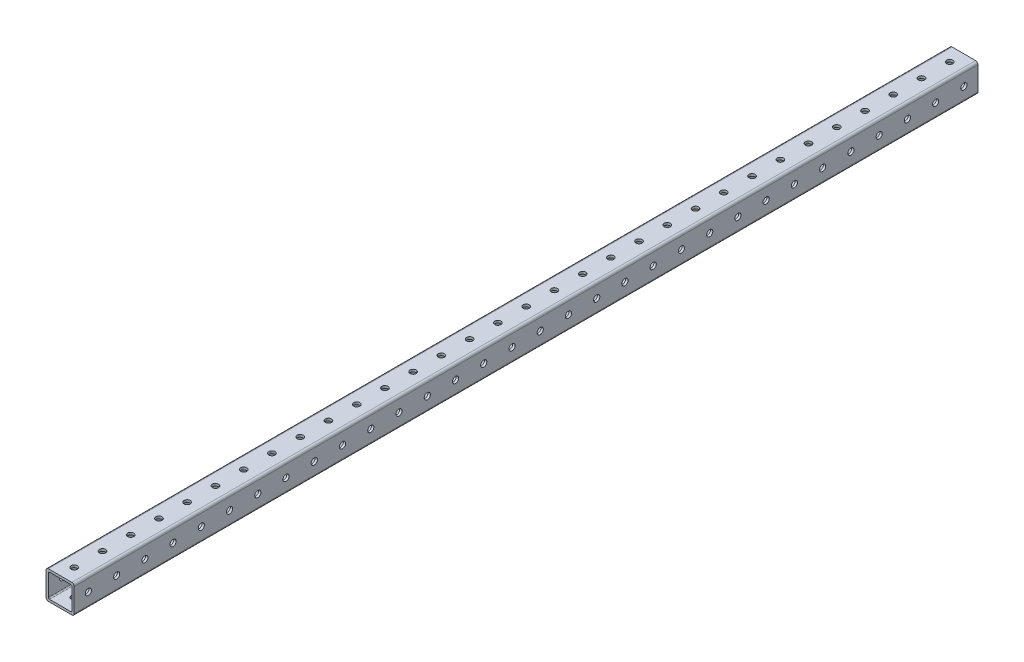
from build123d import *

# Parameters (mm, degrees)
SKETCH1_W                    = 31.75
SKETCH1_H                    = 31.75
EXTRUDE_THIN1_DEPTH          = 609.6
FILLET1_R                    = 1.6002
SKETCH2_R                    = 4.1656
CUT_EXTRUDE1_DEPTH           = 611.195022104
LPATTERN1_COUNT              = 32
LPATTERN1_PITCH              = 38.1
CIRPATTERN1_COUNT            = 2
CIRPATTERN1_ANGLE            = 90
CIRPATTERN1_COPY_1_SKETCH_R  = 4.1656
CIRPATTERN1_COPY_1_DEPTH     = 611.195022104
CIRPATTERN1_COPY_2_SKETCH_R  = 4.1656
CIRPATTERN1_COPY_2_DEPTH     = 611.195022104
CIRPATTERN1_COPY_3_SKETCH_R  = 4.1656
CIRPATTERN1_COPY_3_DEPTH     = 611.195022104
CIRPATTERN1_COPY_4_SKETCH_R  = 4.1656
CIRPATTERN1_COPY_4_DEPTH     = 611.195022104
CIRPATTERN1_COPY_5_SKETCH_R  = 4.1656
CIRPATTERN1_COPY_5_DEPTH     = 611.195022104
CIRPATTERN1_COPY_6_SKETCH_R  = 4.1656
CIRPATTERN1_COPY_6_DEPTH     = 611.195022104
CIRPATTERN1_COPY_7_SKETCH_R  = 4.1656
CIRPATTERN1_COPY_7_DEPTH     = 611.195022104
CIRPATTERN1_COPY_8_SKETCH_R  = 4.1656
CIRPATTERN1_COPY_8_DEPTH     = 611.195022104
CIRPATTERN1_COPY_9_SKETCH_R  = 4.1656
CIRPATTERN1_COPY_9_DEPTH     = 611.195022104
CIRPATTERN1_COPY_10_SKETCH_R = 4.1656
CIRPATTERN1_COPY_10_DEPTH    = 611.195022104
CIRPATTERN1_COPY_11_SKETCH_R = 4.1656
CIRPATTERN1_COPY_11_DEPTH    = 611.195022104
CIRPATTERN1_COPY_12_SKETCH_R = 4.1656
CIRPATTERN1_COPY_12_DEPTH    = 611.195022104
CIRPATTERN1_COPY_13_SKETCH_R = 4.1656
CIRPATTERN1_COPY_13_DEPTH    = 611.195022104
CIRPATTERN1_COPY_14_SKETCH_R = 4.1656
CIRPATTERN1_COPY_14_DEPTH    = 611.195022104
CIRPATTERN1_COPY_15_SKETCH_R = 4.1656
CIRPATTERN1_COPY_15_DEPTH    = 611.195022104
CIRPATTERN1_COPY_16_SKETCH_R = 4.1656
CIRPATTERN1_COPY_16_DEPTH    = 611.195022104
CIRPATTERN1_COPY_17_SKETCH_R = 4.1656
CIRPATTERN1_COPY_17_DEPTH    = 611.195022104
CIRPATTERN1_COPY_18_SKETCH_R = 4.1656
CIRPATTERN1_COPY_18_DEPTH    = 611.195022104
CIRPATTERN1_COPY_19_SKETCH_R = 4.1656
CIRPATTERN1_COPY_19_DEPTH    = 611.195022104
CIRPATTERN1_COPY_20_SKETCH_R = 4.1656
CIRPATTERN1_COPY_20_DEPTH    = 611.195022104
CIRPATTERN1_COPY_21_SKETCH_R = 4.1656
CIRPATTERN1_COPY_21_DEPTH    = 611.195022104
CIRPATTERN1_COPY_22_SKETCH_R = 4.1656
CIRPATTERN1_COPY_22_DEPTH    = 611.195022104
CIRPATTERN1_COPY_23_SKETCH_R = 4.1656
CIRPATTERN1_COPY_23_DEPTH    = 611.195022104
CIRPATTERN1_COPY_24_SKETCH_R = 4.1656
CIRPATTERN1_COPY_24_DEPTH    = 611.195022104
CIRPATTERN1_COPY_25_SKETCH_R = 4.1656
CIRPATTERN1_COPY_25_DEPTH    = 611.195022104
CIRPATTERN1_COPY_26_SKETCH_R = 4.1656
CIRPATTERN1_COPY_26_DEPTH    = 611.195022104
CIRPATTERN1_COPY_27_SKETCH_R = 4.1656
CIRPATTERN1_COPY_27_DEPTH    = 611.195022104
CIRPATTERN1_COPY_28_SKETCH_R = 4.1656
CIRPATTERN1_COPY_28_DEPTH    = 611.195022104
CIRPATTERN1_COPY_29_SKETCH_R = 4.1656
CIRPATTERN1_COPY_29_DEPTH    = 611.195022104
CIRPATTERN1_COPY_30_SKETCH_R = 4.1656
CIRPATTERN1_COPY_30_DEPTH    = 611.195022104
CIRPATTERN1_COPY_31_SKETCH_R = 4.1656
CIRPATTERN1_COPY_31_DEPTH    = 611.195022104


with BuildPart() as part:
    # Sketch1 → Extrude-Thin1 (new, symmetric)
    with BuildSketch(Plane.XY):
        with BuildLine():
            Line((-15.875, 19.05), (15.875, 19.05))
            ThreePointArc((15.875, 19.05), (18.12006403, 18.12006403), (19.05, 15.875))
            Line((19.05, 15.875), (19.05, -15.875))
            ThreePointArc((19.05, -15.875), (18.12006403, -18.12006403), (15.875, -19.05))
            Line((15.875, -19.05), (-15.875, -19.05))
            ThreePointArc((-15.875, -19.05), (-18.12006403, -18.12006403), (-19.05, -15.875))
            Line((-19.05, -15.875), (-19.05, 15.875))
            ThreePointArc((-19.05, 15.875), (-18.12006403, 18.12006403), (-15.875, 19.05))
        make_face()
        Rectangle(SKETCH1_W, SKETCH1_H, mode=Mode.SUBTRACT)
    extrude(amount=EXTRUDE_THIN1_DEPTH, both=True)

    # Fillet1
    fillet1_edges = [part.edges().sort_by_distance(p)[0] for p in [
        (15.875, -15.875, 0),
        (15.875, 15.875, 0),
        (-15.875, 15.875, 0),
        (-15.875, -15.875, 0),
    ]]
    fillet(fillet1_edges, radius=FILLET1_R)

    # Sketch2 → Cut-Extrude1 (cut, symmetric)
    with BuildSketch(Plane(origin=(0, 0, 0), x_dir=(1, 0, 0), z_dir=(0, 1, 0))):
        with Locations(Location((0, -590.55, 0), (0, 0, 270))):
            Circle(SKETCH2_R)
    cut_extrude1 = extrude(amount=CUT_EXTRUDE1_DEPTH, both=True, mode=Mode.SUBTRACT)

    # LPattern1: Cut-Extrude1 ×32
    with Locations(*[(0, 0, -i * LPATTERN1_PITCH) for i in range(1, LPATTERN1_COUNT)]):
        add(cut_extrude1, mode=Mode.SUBTRACT)

    # CirPattern1: Cut-Extrude1 ×2 about axis
    cirpattern1_axis = Axis((0, 0, 590.55), (0, 0, -1))
    for i in range(1, CIRPATTERN1_COUNT):
        add(cut_extrude1.rotate(cirpattern1_axis, i * CIRPATTERN1_ANGLE / (CIRPATTERN1_COUNT - 1)), mode=Mode.SUBTRACT)

    # CirPattern1 copy 1 sketch → CirPattern1 copy 1 (cut, symmetric)
    with BuildSketch(Plane(origin=(0, 0, -38.1), x_dir=(0, -1, 0), z_dir=(1, 0, 0))):
        with Locations(Location((0, -590.55, 0), (0, 0, 270))):
            Circle(CIRPATTERN1_COPY_1_SKETCH_R)
    extrude(amount=CIRPATTERN1_COPY_1_DEPTH, both=True, mode=Mode.SUBTRACT)

    # CirPattern1 copy 2 sketch → CirPattern1 copy 2 (cut, symmetric)
    with BuildSketch(Plane(origin=(0, 0, -76.2), x_dir=(0, -1, 0), z_dir=(1, 0, 0))):
        with Locations(Location((0, -590.55, 0), (0, 0, 270))):
            Circle(CIRPATTERN1_COPY_2_SKETCH_R)
    extrude(amount=CIRPATTERN1_COPY_2_DEPTH, both=True, mode=Mode.SUBTRACT)

    # CirPattern1 copy 3 sketch → CirPattern1 copy 3 (cut, symmetric)
    with BuildSketch(Plane(origin=(0, 0, -114.3), x_dir=(0, -1, 0), z_dir=(1, 0, 0))):
        with Locations(Location((0, -590.55, 0), (0, 0, 270))):
            Circle(CIRPATTERN1_COPY_3_SKETCH_R)
    extrude(amount=CIRPATTERN1_COPY_3_DEPTH, both=True, mode=Mode.SUBTRACT)

    # CirPattern1 copy 4 sketch → CirPattern1 copy 4 (cut, symmetric)
    with BuildSketch(Plane(origin=(0, 0, -152.4), x_dir=(0, -1, 0), z_dir=(1, 0, 0))):
        with Locations(Location((0, -590.55, 0), (0, 0, 270))):
            Circle(CIRPATTERN1_COPY_4_SKETCH_R)
    extrude(amount=CIRPATTERN1_COPY_4_DEPTH, both=True, mode=Mode.SUBTRACT)

    # CirPattern1 copy 5 sketch → CirPattern1 copy 5 (cut, symmetric)
    with BuildSketch(Plane(origin=(0, 0, -190.5), x_dir=(0, -1, 0), z_dir=(1, 0, 0))):
        with Locations(Location((0, -590.55, 0), (0, 0, 270))):
            Circle(CIRPATTERN1_COPY_5_SKETCH_R)
    extrude(amount=CIRPATTERN1_COPY_5_DEPTH, both=True, mode=Mode.SUBTRACT)

    # CirPattern1 copy 6 sketch → CirPattern1 copy 6 (cut, symmetric)
    with BuildSketch(Plane(origin=(0, 0, -228.6), x_dir=(0, -1, 0), z_dir=(1, 0, 0))):
        with Locations(Location((0, -590.55, 0), (0, 0, 270))):
            Circle(CIRPATTERN1_COPY_6_SKETCH_R)
    extrude(amount=CIRPATTERN1_COPY_6_DEPTH, both=True, mode=Mode.SUBTRACT)

    # CirPattern1 copy 7 sketch → CirPattern1 copy 7 (cut, symmetric)
    with BuildSketch(Plane(origin=(0, 0, -266.7), x_dir=(0, -1, 0), z_dir=(1, 0, 0))):
        with Locations(Location((0, -590.55, 0), (0, 0, 270))):
            Circle(CIRPATTERN1_COPY_7_SKETCH_R)
    extrude(amount=CIRPATTERN1_COPY_7_DEPTH, both=True, mode=Mode.SUBTRACT)

    # CirPattern1 copy 8 sketch → CirPattern1 copy 8 (cut, symmetric)
    with BuildSketch(Plane(origin=(0, 0, -304.8), x_dir=(0, -1, 0), z_dir=(1, 0, 0))):
        with Locations(Location((0, -590.55, 0), (0, 0, 270))):
            Circle(CIRPATTERN1_COPY_8_SKETCH_R)
    extrude(amount=CIRPATTERN1_COPY_8_DEPTH, both=True, mode=Mode.SUBTRACT)

    # CirPattern1 copy 9 sketch → CirPattern1 copy 9 (cut, symmetric)
    with BuildSketch(Plane(origin=(0, 0, -342.9), x_dir=(0, -1, 0), z_dir=(1, 0, 0))):
        with Locations(Location((0, -590.55, 0), (0, 0, 270))):
            Circle(CIRPATTERN1_COPY_9_SKETCH_R)
    extrude(amount=CIRPATTERN1_COPY_9_DEPTH, both=True, mode=Mode.SUBTRACT)

    # CirPattern1 copy 10 sketch → CirPattern1 copy 10 (cut, symmetric)
    with BuildSketch(Plane(origin=(0, 0, -381), x_dir=(0, -1, 0), z_dir=(1, 0, 0))):
        with Locations(Location((0, -590.55, 0), (0, 0, 270))):
            Circle(CIRPATTERN1_COPY_10_SKETCH_R)
    extrude(amount=CIRPATTERN1_COPY_10_DEPTH, both=True, mode=Mode.SUBTRACT)

    # CirPattern1 copy 11 sketch → CirPattern1 copy 11 (cut, symmetric)
    with BuildSketch(Plane(origin=(0, 0, -419.1), x_dir=(0, -1, 0), z_dir=(1, 0, 0))):
        with Locations(Location((0, -590.55, 0), (0, 0, 270))):
            Circle(CIRPATTERN1_COPY_11_SKETCH_R)
    extrude(amount=CIRPATTERN1_COPY_11_DEPTH, both=True, mode=Mode.SUBTRACT)

    # CirPattern1 copy 12 sketch → CirPattern1 copy 12 (cut, symmetric)
    with BuildSketch(Plane(origin=(0, 0, -457.2), x_dir=(0, -1, 0), z_dir=(1, 0, 0))):
        with Locations(Location((0, -590.55, 0), (0, 0, 270))):
            Circle(CIRPATTERN1_COPY_12_SKETCH_R)
    extrude(amount=CIRPATTERN1_COPY_12_DEPTH, both=True, mode=Mode.SUBTRACT)

    # CirPattern1 copy 13 sketch → CirPattern1 copy 13 (cut, symmetric)
    with BuildSketch(Plane(origin=(0, 0, -495.3), x_dir=(0, -1, 0), z_dir=(1, 0, 0))):
        with Locations(Location((0, -590.55, 0), (0, 0, 270))):
            Circle(CIRPATTERN1_COPY_13_SKETCH_R)
    extrude(amount=CIRPATTERN1_COPY_13_DEPTH, both=True, mode=Mode.SUBTRACT)

    # CirPattern1 copy 14 sketch → CirPattern1 copy 14 (cut, symmetric)
    with BuildSketch(Plane(origin=(0, 0, -533.4), x_dir=(0, -1, 0), z_dir=(1, 0, 0))):
        with Locations(Location((0, -590.55, 0), (0, 0, 270))):
            Circle(CIRPATTERN1_COPY_14_SKETCH_R)
    extrude(amount=CIRPATTERN1_COPY_14_DEPTH, both=True, mode=Mode.SUBTRACT)

    # CirPattern1 copy 15 sketch → CirPattern1 copy 15 (cut, symmetric)
    with BuildSketch(Plane(origin=(0, 0, -571.5), x_dir=(0, -1, 0), z_dir=(1, 0, 0))):
        with Locations(Location((0, -590.55, 0), (0, 0, 270))):
            Circle(CIRPATTERN1_COPY_15_SKETCH_R)
    extrude(amount=CIRPATTERN1_COPY_15_DEPTH, both=True, mode=Mode.SUBTRACT)

    # CirPattern1 copy 16 sketch → CirPattern1 copy 16 (cut, symmetric)
    with BuildSketch(Plane(origin=(0, 0, -609.6), x_dir=(0, -1, 0), z_dir=(1, 0, 0))):
        with Locations(Location((0, -590.55, 0), (0, 0, 270))):
            Circle(CIRPATTERN1_COPY_16_SKETCH_R)
    extrude(amount=CIRPATTERN1_COPY_16_DEPTH, both=True, mode=Mode.SUBTRACT)

    # CirPattern1 copy 17 sketch → CirPattern1 copy 17 (cut, symmetric)
    with BuildSketch(Plane(origin=(0, 0, -647.7), x_dir=(0, -1, 0), z_dir=(1, 0, 0))):
        with Locations(Location((0, -590.55, 0), (0, 0, 270))):
            Circle(CIRPATTERN1_COPY_17_SKETCH_R)
    extrude(amount=CIRPATTERN1_COPY_17_DEPTH, both=True, mode=Mode.SUBTRACT)

    # CirPattern1 copy 18 sketch → CirPattern1 copy 18 (cut, symmetric)
    with BuildSketch(Plane(origin=(0, 0, -685.8), x_dir=(0, -1, 0), z_dir=(1, 0, 0))):
        with Locations(Location((0, -590.55, 0), (0, 0, 270))):
            Circle(CIRPATTERN1_COPY_18_SKETCH_R)
    extrude(amount=CIRPATTERN1_COPY_18_DEPTH, both=True, mode=Mode.SUBTRACT)

    # CirPattern1 copy 19 sketch → CirPattern1 copy 19 (cut, symmetric)
    with BuildSketch(Plane(origin=(0, 0, -723.9), x_dir=(0, -1, 0), z_dir=(1, 0, 0))):
        with Locations(Location((0, -590.55, 0), (0, 0, 270))):
            Circle(CIRPATTERN1_COPY_19_SKETCH_R)
    extrude(amount=CIRPATTERN1_COPY_19_DEPTH, both=True, mode=Mode.SUBTRACT)

    # CirPattern1 copy 20 sketch → CirPattern1 copy 20 (cut, symmetric)
    with BuildSketch(Plane(origin=(0, 0, -762), x_dir=(0, -1, 0), z_dir=(1, 0, 0))):
        with Locations(Location((0, -590.55, 0), (0, 0, 270))):
            Circle(CIRPATTERN1_COPY_20_SKETCH_R)
    extrude(amount=CIRPATTERN1_COPY_20_DEPTH, both=True, mode=Mode.SUBTRACT)

    # CirPattern1 copy 21 sketch → CirPattern1 copy 21 (cut, symmetric)
    with BuildSketch(Plane(origin=(0, 0, -800.1), x_dir=(0, -1, 0), z_dir=(1, 0, 0))):
        with Locations(Location((0, -590.55, 0), (0, 0, 270))):
            Circle(CIRPATTERN1_COPY_21_SKETCH_R)
    extrude(amount=CIRPATTERN1_COPY_21_DEPTH, both=True, mode=Mode.SUBTRACT)

    # CirPattern1 copy 22 sketch → CirPattern1 copy 22 (cut, symmetric)
    with BuildSketch(Plane(origin=(0, 0, -838.2), x_dir=(0, -1, 0), z_dir=(1, 0, 0))):
        with Locations(Location((0, -590.55, 0), (0, 0, 270))):
            Circle(CIRPATTERN1_COPY_22_SKETCH_R)
    extrude(amount=CIRPATTERN1_COPY_22_DEPTH, both=True, mode=Mode.SUBTRACT)

    # CirPattern1 copy 23 sketch → CirPattern1 copy 23 (cut, symmetric)
    with BuildSketch(Plane(origin=(0, 0, -876.3), x_dir=(0, -1, 0), z_dir=(1, 0, 0))):
        with Locations(Location((0, -590.55, 0), (0, 0, 270))):
            Circle(CIRPATTERN1_COPY_23_SKETCH_R)
    extrude(amount=CIRPATTERN1_COPY_23_DEPTH, both=True, mode=Mode.SUBTRACT)

    # CirPattern1 copy 24 sketch → CirPattern1 copy 24 (cut, symmetric)
    with BuildSketch(Plane(origin=(0, 0, -914.4), x_dir=(0, -1, 0), z_dir=(1, 0, 0))):
        with Locations(Location((0, -590.55, 0), (0, 0, 270))):
            Circle(CIRPATTERN1_COPY_24_SKETCH_R)
    extrude(amount=CIRPATTERN1_COPY_24_DEPTH, both=True, mode=Mode.SUBTRACT)

    # CirPattern1 copy 25 sketch → CirPattern1 copy 25 (cut, symmetric)
    with BuildSketch(Plane(origin=(0, 0, -952.5), x_dir=(0, -1, 0), z_dir=(1, 0, 0))):
        with Locations(Location((0, -590.55, 0), (0, 0, 270))):
            Circle(CIRPATTERN1_COPY_25_SKETCH_R)
    extrude(amount=CIRPATTERN1_COPY_25_DEPTH, both=True, mode=Mode.SUBTRACT)

    # CirPattern1 copy 26 sketch → CirPattern1 copy 26 (cut, symmetric)
    with BuildSketch(Plane(origin=(0, 0, -990.6), x_dir=(0, -1, 0), z_dir=(1, 0, 0))):
        with Locations(Location((0, -590.55, 0), (0, 0, 270))):
            Circle(CIRPATTERN1_COPY_26_SKETCH_R)
    extrude(amount=CIRPATTERN1_COPY_26_DEPTH, both=True, mode=Mode.SUBTRACT)

    # CirPattern1 copy 27 sketch → CirPattern1 copy 27 (cut, symmetric)
    with BuildSketch(Plane(origin=(0, 0, -1028.7), x_dir=(0, -1, 0), z_dir=(1, 0, 0))):
        with Locations(Location((0, -590.55, 0), (0, 0, 270))):
            Circle(CIRPATTERN1_COPY_27_SKETCH_R)
    extrude(amount=CIRPATTERN1_COPY_27_DEPTH, both=True, mode=Mode.SUBTRACT)

    # CirPattern1 copy 28 sketch → CirPattern1 copy 28 (cut, symmetric)
    with BuildSketch(Plane(origin=(0, 0, -1066.8), x_dir=(0, -1, 0), z_dir=(1, 0, 0))):
        with Locations(Location((0, -590.55, 0), (0, 0, 270))):
            Circle(CIRPATTERN1_COPY_28_SKETCH_R)
    extrude(amount=CIRPATTERN1_COPY_28_DEPTH, both=True, mode=Mode.SUBTRACT)

    # CirPattern1 copy 29 sketch → CirPattern1 copy 29 (cut, symmetric)
    with BuildSketch(Plane(origin=(0, 0, -1104.9), x_dir=(0, -1, 0), z_dir=(1, 0, 0))):
        with Locations(Location((0, -590.55, 0), (0, 0, 270))):
            Circle(CIRPATTERN1_COPY_29_SKETCH_R)
    extrude(amount=CIRPATTERN1_COPY_29_DEPTH, both=True, mode=Mode.SUBTRACT)

    # CirPattern1 copy 30 sketch → CirPattern1 copy 30 (cut, symmetric)
    with BuildSketch(Plane(origin=(0, 0, -1143), x_dir=(0, -1, 0), z_dir=(1, 0, 0))):
        with Locations(Location((0, -590.55, 0), (0, 0, 270))):
            Circle(CIRPATTERN1_COPY_30_SKETCH_R)
    extrude(amount=CIRPATTERN1_COPY_30_DEPTH, both=True, mode=Mode.SUBTRACT)

    # CirPattern1 copy 31 sketch → CirPattern1 copy 31 (cut, symmetric)
    with BuildSketch(Plane(origin=(0, 0, -1181.1), x_dir=(0, -1, 0), z_dir=(1, 0, 0))):
        with Locations(Location((0, -590.55, 0), (0, 0, 270))):
            Circle(CIRPATTERN1_COPY_31_SKETCH_R)
    extrude(amount=CIRPATTERN1_COPY_31_DEPTH, both=True, mode=Mode.SUBTRACT)


solid = part.part
